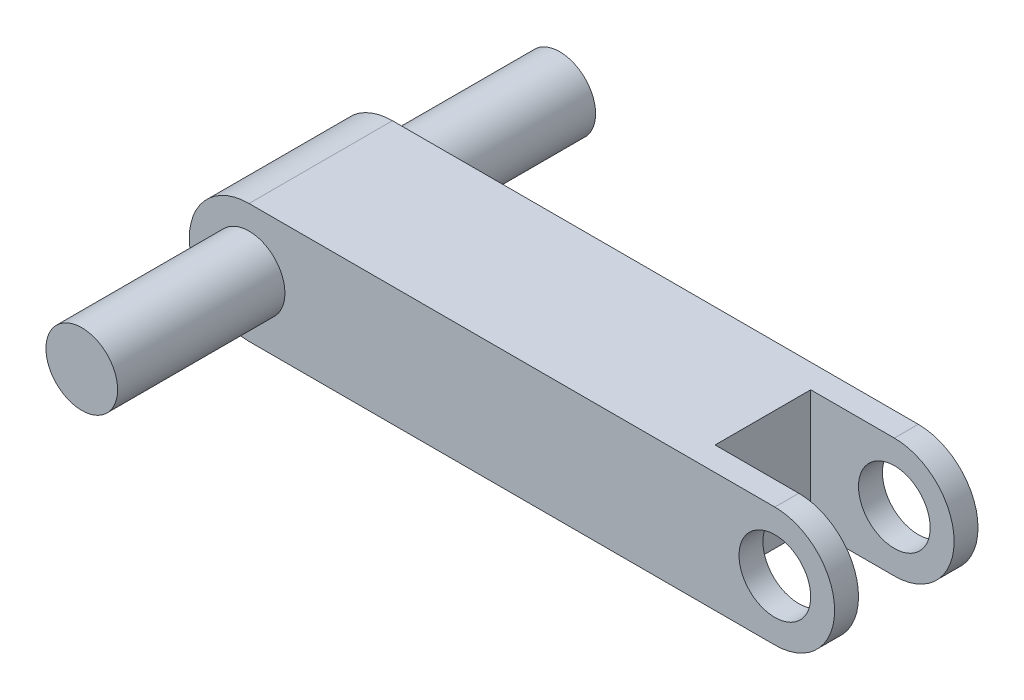
from build123d import *

# Parameters (mm, degrees)
BOSS_EXTRUDE1_DEPTH = 60
SKETCH2_R           = 15
BOSS_EXTRUDE2_DEPTH = 70
BOSS_EXTRUDE3_START = 70
SKETCH3_R           = 15
BOSS_EXTRUDE3_DEPTH = 70
SKETCH4_W           = 60
SKETCH4_H           = 40
CUT_EXTRUDE1_DEPTH  = 75
SKETCH5_R           = 15
CUT_EXTRUDE2_DEPTH  = 75


with BuildPart() as part:
    # Sketch1 → Boss-Extrude1 (new body)
    with BuildSketch(Plane.XY):
        with BuildLine():
            Line((-91.343193625, 24.62689066), (128.656806375, 24.62689066))
            ThreePointArc((128.656806375, 24.62689066), (153.656806375, -0.37310934), (128.656806375, -25.37310934))
            Line((128.656806375, -25.37310934), (-91.343193625, -25.37310934))
            ThreePointArc((-91.343193625, -25.37310934), (-116.343193625, -0.37310934), (-91.343193625, 24.62689066))
        make_face()
    extrude(amount=BOSS_EXTRUDE1_DEPTH)

    # Sketch2 → Boss-Extrude2 (add)
    with BuildSketch(Plane.XY.offset(60)):
        with Locations((-91.343193625, -0.37310934)):
            Circle(SKETCH2_R)
    extrude(amount=BOSS_EXTRUDE2_DEPTH)

    # Sketch3 → Boss-Extrude3 (add)
    with BuildSketch(Plane(origin=(0, 0, 0), x_dir=(-1, 0, 0), z_dir=(0, 0, -1)).offset(BOSS_EXTRUDE3_START)):
        with Locations(Location((91.343193625, -0.37310934, 0), (0, 0, 180))):
            Circle(SKETCH3_R)
    extrude(amount=-BOSS_EXTRUDE3_DEPTH)

    # Sketch4 → Cut-Extrude1 (cut)
    with BuildSketch(Plane(origin=(0, 24.62689066, 0), x_dir=(1, 0, 0), z_dir=(0, 1, 0))):
        with Locations((123.656806375, -30)):
            Rectangle(SKETCH4_W, SKETCH4_H)
    extrude(amount=-CUT_EXTRUDE1_DEPTH, mode=Mode.SUBTRACT)

    # Sketch5 → Cut-Extrude2 (cut)
    with BuildSketch(Plane.XY.offset(60)):
        with Locations((128.656806375, -0.37310934)):
            Circle(SKETCH5_R)
    extrude(amount=-CUT_EXTRUDE2_DEPTH, mode=Mode.SUBTRACT)


solid = part.part
